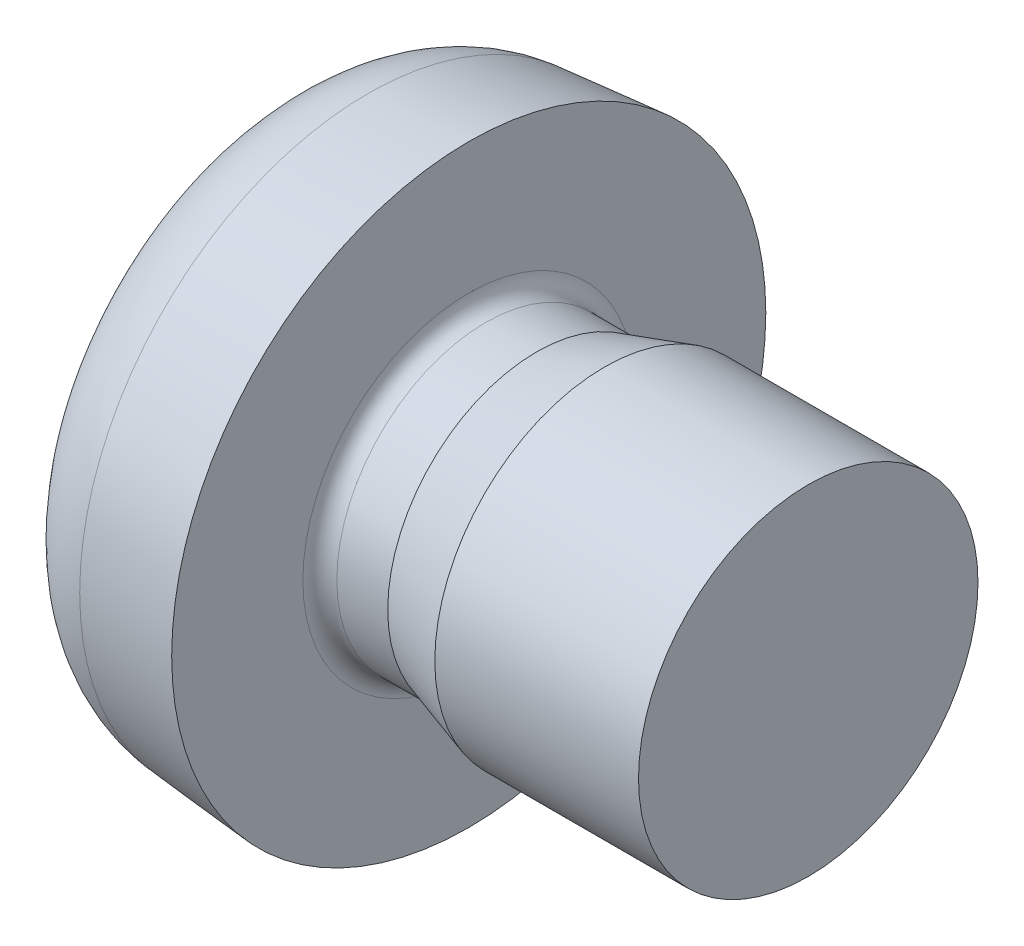
from build123d import *

# Parameters (mm, degrees)
CUT_EXTRUDE_1_DEPTH = 0.65


with BuildPart() as part:
    # ｽｹｯﾁ1 → 回転1 (revolve)
    with BuildSketch(Plane.XY, mode=Mode.PRIVATE) as revolve_1_sk:
        with BuildLine():
            Line((-0.593854493, 1.698044464), (0, 1.75))
            Line((0, 1.75), (0, 0.97725))
            ThreePointArc((0, 0.97725), (0.029289322, 0.906539322), (0.1, 0.87725))
            Line((0.1, 0.87725), (0.4, 0.87725))
            Line((0.4, 0.87725), (0.8, 1))
            Line((0.8, 1), (2, 1))
            Line((2, 1), (2, 0))
            Line((2, 0), (-1.3, 0))
            ThreePointArc((-1.3, 0), (-1.254061978, 0.641351616), (-1.117185824, 1.269608821))
            ThreePointArc((-1.117185824, 1.269608821), (-0.921639459, 1.564590934), (-0.593854493, 1.698044464))
        make_face()
    revolve(revolve_1_sk.sketch.rotate(Axis((2, 0, 0), (-1, 0, 0)), 270), axis=Axis((2, 0, 0), (-1, 0, 0)))

    # ｽｹｯﾁ2 → ｶｯﾄ - 押し出し1 (cut)
    with BuildSketch(Plane(origin=(-1.3, 0, 0), x_dir=(0, 0, -1), z_dir=(1, 0, 0))):
        with BuildLine():
            Line((-1.1, 0.233333333), (-1.1, -0.233333333))
            Line((-1.1, -0.233333333), (-0.583333333, -0.233333333))
            ThreePointArc((-0.583333333, -0.233333333), (-0.33584596, -0.33584596), (-0.233333333, -0.583333333))
            Line((-0.233333333, -0.583333333), (-0.233333333, -1.1))
            Line((-0.233333333, -1.1), (0.233333333, -1.1))
            Line((0.233333333, -1.1), (0.233333333, -0.583333333))
            ThreePointArc((0.233333333, -0.583333333), (0.33584596, -0.33584596), (0.583333333, -0.233333333))
            Line((0.583333333, -0.233333333), (1.1, -0.233333333))
            Line((1.1, -0.233333333), (1.1, 0.233333333))
            Line((1.1, 0.233333333), (0.583333333, 0.233333333))
            ThreePointArc((0.583333333, 0.233333333), (0.33584596, 0.33584596), (0.233333333, 0.583333333))
            Line((0.233333333, 0.583333333), (0.233333333, 1.1))
            Line((0.233333333, 1.1), (-0.233333333, 1.1))
            Line((-0.233333333, 1.1), (-0.233333333, 0.583333333))
            ThreePointArc((-0.233333333, 0.583333333), (-0.33584596, 0.33584596), (-0.583333333, 0.233333333))
            Line((-0.583333333, 0.233333333), (-1.1, 0.233333333))
        make_face()
    extrude(amount=CUT_EXTRUDE_1_DEPTH, mode=Mode.SUBTRACT)


solid = part.part
